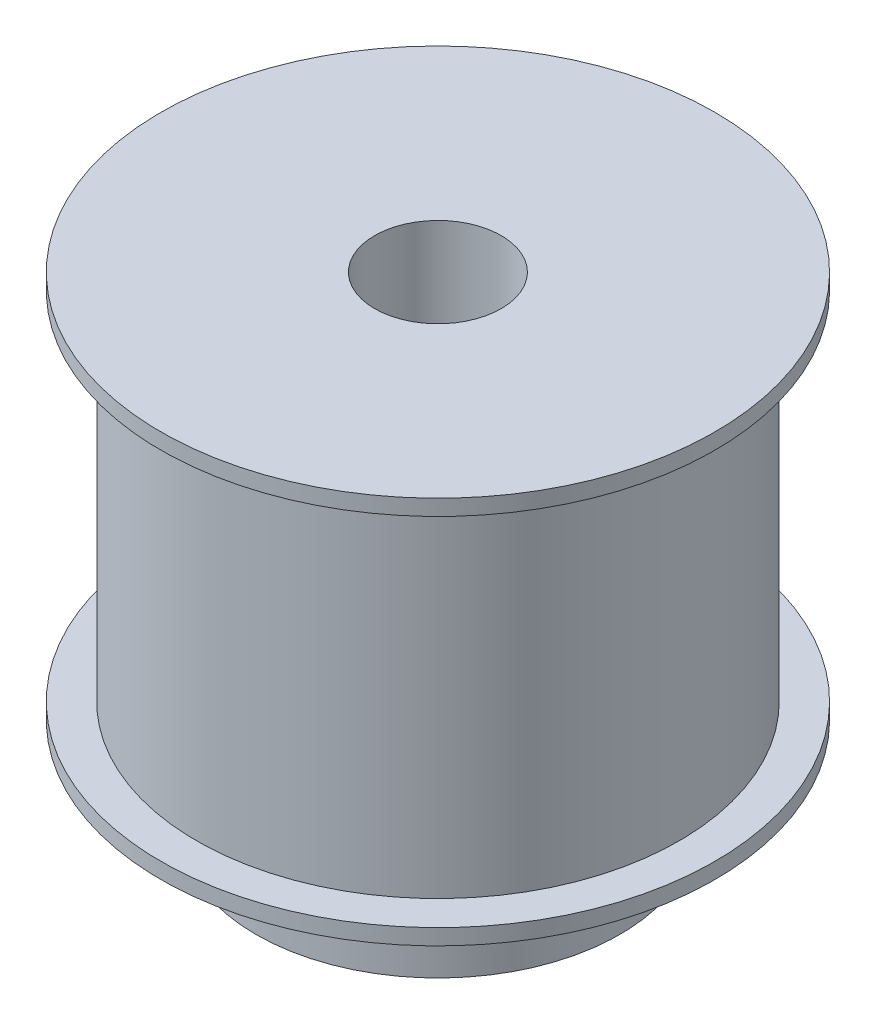
from build123d import *

# Parameters (mm, degrees)
SKETCH3_R          = 4
CUT_EXTRUDE1_DEPTH = 30.5


with BuildPart() as part:
    # Sketch2 → Revolve1 (revolve)
    with BuildSketch(Plane.XY, mode=Mode.PRIVATE) as revolve1_sk:
        Polygon((0, 0), (0, -6), (-11.5, -6), (-11.5, 0), (-17.5, 0), (-17.5, 1), (-15.25, 1), (-15.25, 23.5), (-17.5, 23.5), (-17.5, 24.5), (0, 24.5), (0, 23.5), (0, 1), align=None)
    revolve(revolve1_sk.sketch.rotate(Axis((0, 1, 0), (0, 1, 0)), 270), axis=Axis((0, 1, 0), (0, 1, 0)))

    # Sketch3 → Cut-Extrude1 (cut)
    with BuildSketch(Plane(origin=(0, 24.5, 0), x_dir=(1, 0, 0), z_dir=(0, 1, 0))):
        with Locations(Location((0, 0, 0), (0, 0, 270))):
            Circle(SKETCH3_R)
    extrude(amount=-CUT_EXTRUDE1_DEPTH, mode=Mode.SUBTRACT)


solid = part.part
